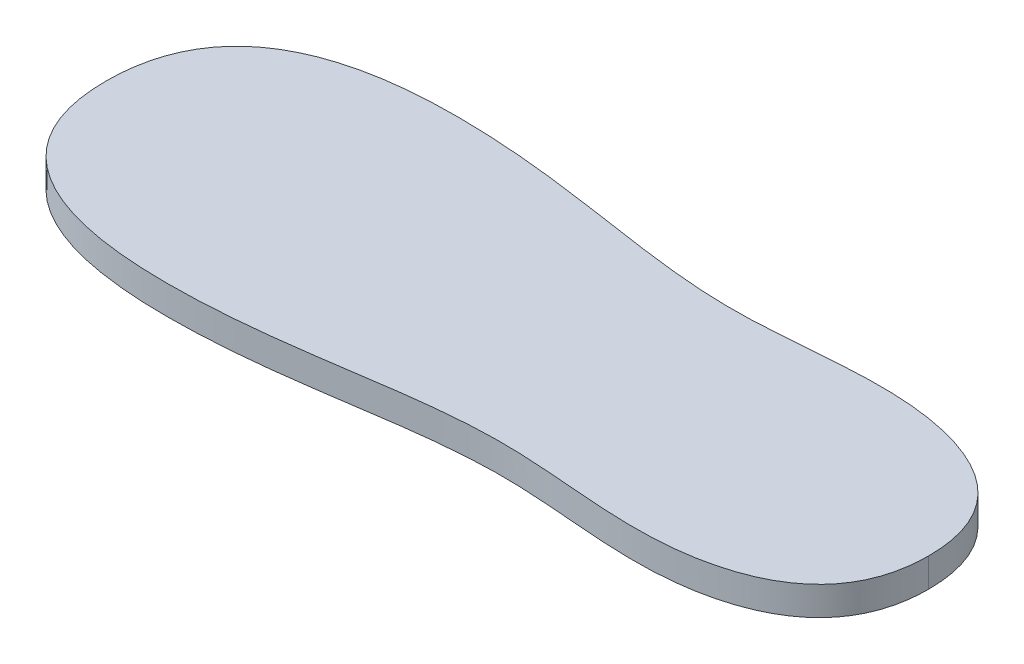
from build123d import *

# Parameters (mm, degrees)
BOSS_EXTRUDE1_DEPTH = 10


with BuildPart() as part:
    # Sketch1 → Boss-Extrude1 (new body)
    with BuildSketch(Plane(origin=(0, 0, 0), x_dir=(1, 0, 0), z_dir=(0, 1, 0))):
        with BuildLine():
            add(Edge.make_bspline(
                [(0, 0), (0, 45.713966925), (90.883476186, 57.250170405), (167.974629399, 33.009955562), (244.959624554, 49.469348186), (285, 25.385780233), (285, 0)],
                knots=[0, 0, 0, 0, 0.296676059, 0.612720521, 0.832853717, 1, 1, 1, 1], degree=3))
            add(Edge.make_bspline(
                [(0, 0), (0, -45.713966925), (90.883476186, -57.250170405), (167.974629399, -33.009955562), (244.959624554, -49.469348186), (285, -25.385780233), (285, 0)],
                knots=[0, 0, 0, 0, 0.296676059, 0.612720521, 0.832853717, 1, 1, 1, 1], degree=3))
        make_face()
    extrude(amount=BOSS_EXTRUDE1_DEPTH)


solid = part.part
